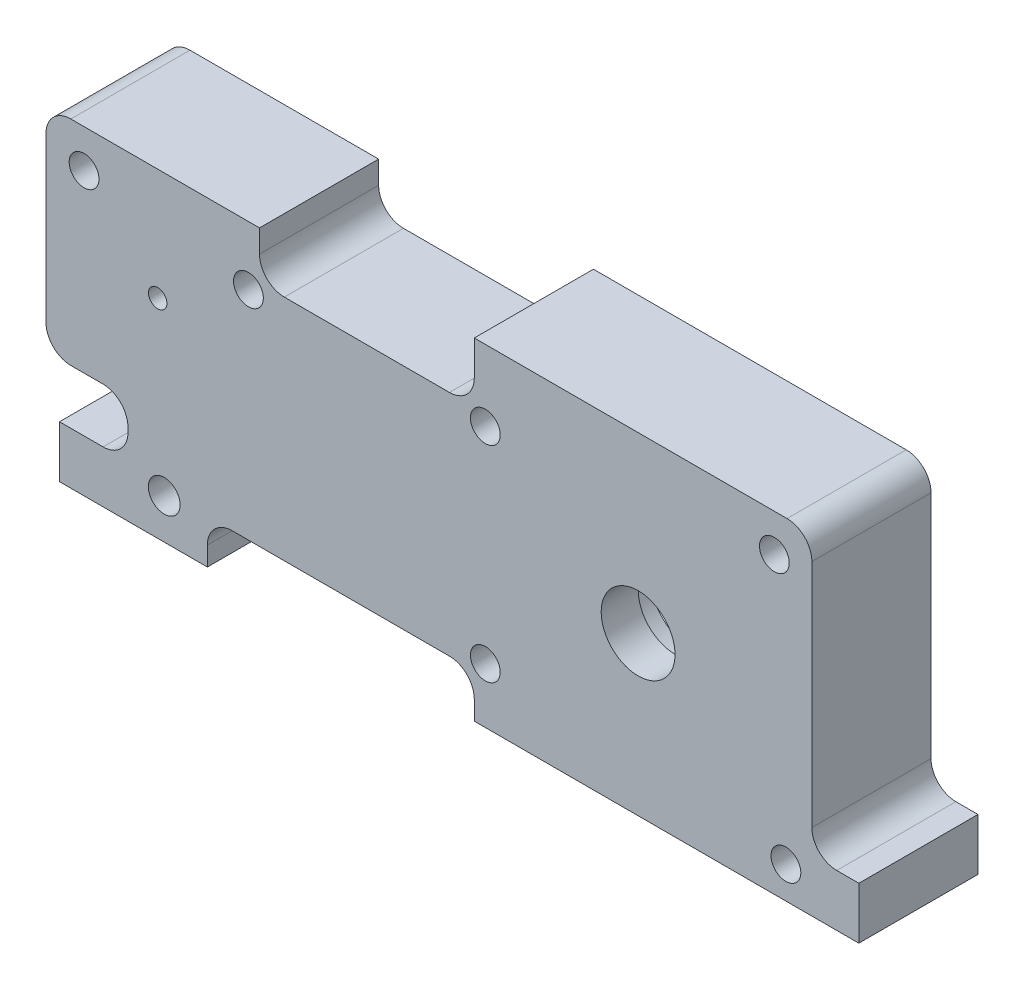
from build123d import *

# Parameters (mm, degrees)
EXTRUDE3_DEPTH = 15.24
EXTRUDE4_DEPTH = 6.477
SKETCH7_R      = 7.8994
EXTRUDE5_DEPTH = 4.0132
SKETCH8_R      = 2.2987
EXTRUDE6_DEPTH = 4.2926
SKETCH9_R      = 4.4196
EXTRUDE7_DEPTH = 4.4196
SKETCH10_R     = 4.7244
SKETCH10_R_2   = 1.905
SKETCH10_R_3   = 1.179287719
SKETCH10_R_4   = 2.031992692
EXTRUDE8_DEPTH = 17.5768


with BuildPart() as part:
    # Sketch4 → Extrude3 (new body)
    with BuildSketch(Plane.XY):
        with BuildLine():
            Line((-42.343481517, -2.990600597), (-42.343481517, 17.964399403))
            ThreePointArc((-42.343481517, 17.964399403), (-41.413545547, 20.209463433), (-39.168481517, 21.139399403))
            Line((-39.168481517, 21.139399403), (-15.038481517, 21.139399403))
            Line((-15.038481517, 21.139399403), (-15.038481517, 18.236569756))
            ThreePointArc((-15.038481517, 18.236569756), (-14.108545547, 15.991505726), (-11.863481517, 15.061569756))
            Line((-11.863481517, 15.061569756), (9.257081626, 15.061569756))
            ThreePointArc((9.257081626, 15.061569756), (11.502145656, 15.991505726), (12.432081626, 18.236569756))
            Line((12.432081626, 18.236569756), (12.432081626, 22.681569756))
            Line((12.432081626, 22.681569756), (52.437081626, 22.681569756))
            ThreePointArc((52.437081626, 22.681569756), (54.682145656, 21.751633786), (55.612081626, 19.506569756))
            Line((55.612081626, 19.506569756), (55.612081626, -9.945714332))
            ThreePointArc((55.612081626, -9.945714332), (56.542017596, -12.190778362), (58.787081626, -13.120714332))
            Line((58.787081626, -13.120714332), (61.618454053, -13.120714332))
            Line((61.618454053, -13.120714332), (61.618454053, -19.76149571))
            Line((61.618454053, -19.76149571), (12.432081626, -19.76149571))
            Line((12.432081626, -19.76149571), (12.432081626, -17.323430244))
            ThreePointArc((12.432081626, -17.323430244), (11.502145656, -15.078366214), (9.257081626, -14.148430244))
            Line((9.257081626, -14.148430244), (-18.530518374, -14.148430244))
            ThreePointArc((-18.530518374, -14.148430244), (-20.775582404, -15.078366214), (-21.705518374, -17.323430244))
            Line((-21.705518374, -17.323430244), (-21.705518374, -19.76149571))
            Line((-21.705518374, -19.76149571), (-40.618560355, -19.76149571))
            Line((-40.618560355, -19.76149571), (-40.618560355, -13.120714332))
            Line((-40.618560355, -13.120714332), (-35.040518374, -13.120714332))
            ThreePointArc((-35.040518374, -13.120714332), (-32.795454344, -12.190778362), (-31.865518374, -9.945714332))
            Line((-31.865518374, -9.945714332), (-31.865518374, -9.340600597))
            ThreePointArc((-31.865518374, -9.340600597), (-32.795454344, -7.095536567), (-35.040518374, -6.165600597))
            Line((-35.040518374, -6.165600597), (-39.168481517, -6.165600597))
            ThreePointArc((-39.168481517, -6.165600597), (-41.413545547, -5.235664628), (-42.343481517, -2.990600597))
        make_face()
    extrude(amount=EXTRUDE3_DEPTH)

    # Sketch1 → Extrude4 (cut)
    with BuildSketch(Plane.XY):
        with BuildLine():
            Line((-35.993481517, 11.614399403), (-35.993481517, 2.089399403))
            ThreePointArc((-35.993481517, 2.089399403), (-35.063545547, -0.155664628), (-32.818481517, -1.085600597))
            Line((-32.818481517, -1.085600597), (-26.785518374, -1.085600597))
            Line((-26.785518374, -1.085600597), (-26.785518374, -5.893430244))
            ThreePointArc((-26.785518374, -5.893430244), (-25.855582404, -8.138494274), (-23.610518374, -9.068430244))
            Line((-23.610518374, -9.068430244), (17.512081626, -9.068430244))
            Line((17.512081626, -9.068430244), (17.512081626, -12.243430244))
            ThreePointArc((17.512081626, -12.243430244), (18.442017596, -14.488494274), (20.687081626, -15.418430244))
            Line((20.687081626, -15.418430244), (46.087081626, -15.418430244))
            ThreePointArc((46.087081626, -15.418430244), (48.332145656, -14.488494274), (49.262081626, -12.243430244))
            Line((49.262081626, -12.243430244), (49.262081626, 13.156569756))
            ThreePointArc((49.262081626, 13.156569756), (48.332145656, 15.401633786), (46.087081626, 16.331569756))
            Line((46.087081626, 16.331569756), (20.687081626, 16.331569756))
            ThreePointArc((20.687081626, 16.331569756), (18.442017596, 15.401633786), (17.512081626, 13.156569756))
            Line((17.512081626, 13.156569756), (17.512081626, 9.981569756))
            Line((17.512081626, 9.981569756), (-20.118481517, 9.981569756))
            Line((-20.118481517, 9.981569756), (-20.118481517, 11.614399403))
            ThreePointArc((-20.118481517, 11.614399403), (-21.048417487, 13.859463433), (-23.293481517, 14.789399403))
            Line((-23.293481517, 14.789399403), (-32.818481517, 14.789399403))
            ThreePointArc((-32.818481517, 14.789399403), (-35.063545547, 13.859463433), (-35.993481517, 11.614399403))
        make_face()
    extrude(amount=EXTRUDE4_DEPTH, mode=Mode.SUBTRACT)

    # Sketch7 → Extrude5 (cut)
    with BuildSketch(Plane(origin=(0, 0, 6.477), x_dir=(-1, 0, 0), z_dir=(0, 0, -1))):
        with Locations((-33.387081626, 0.456569756)):
            Circle(SKETCH7_R)
    extrude(amount=-EXTRUDE5_DEPTH, mode=Mode.SUBTRACT)

    # Sketch8 → Extrude6 (cut)
    with BuildSketch(Plane(origin=(0, 0, 6.477), x_dir=(-1, 0, 0), z_dir=(0, 0, -1))):
        with Locations((-12.305081626, 0.456569756)):
            Circle(SKETCH8_R)
        with Locations((2.477718374, 0.456569756)):
            Circle(SKETCH8_R)
        with Locations((17.260518374, 0.456569756)):
            Circle(SKETCH8_R)
    extrude(amount=-EXTRUDE6_DEPTH, mode=Mode.SUBTRACT)

    # Sketch9 → Extrude7 (cut)
    with BuildSketch(Plane(origin=(0, 0, 6.477), x_dir=(-1, 0, 0), z_dir=(0, 0, -1))):
        with Locations((28.055981517, 6.851899403)):
            Circle(SKETCH9_R)
    extrude(amount=-EXTRUDE7_DEPTH, mode=Mode.SUBTRACT)

    # Sketch10 → Extrude8 (cut, symmetric)
    with BuildSketch(Plane(origin=(0, 0, 10.4902), x_dir=(-1, 0, 0), z_dir=(0, 0, -1))):
        with Locations((-33.387081626, 0.456569756)):
            Circle(SKETCH10_R)
        with Locations((-52.287415303, -15.678066597)):
            Circle(SKETCH10_R_2)
        with Locations((28.055981517, 6.851899403)):
            Circle(SKETCH10_R_3)
        with Locations((37.474326825, 16.270244711)):
            Circle(SKETCH10_R_2)
        with Locations((-13.846294556, 13.596903192)):
            Circle(SKETCH10_R_2)
        with Locations((-13.846294556, -12.683763681)):
            Circle(SKETCH10_R_2)
        with Locations((27.221195322, -14.622613425)):
            Circle(SKETCH10_R_4)
        with Locations((-50.814973838, 17.884461968)):
            Circle(SKETCH10_R_2)
        with Locations((16.452694446, 13.596903192)):
            Circle(SKETCH10_R_2)
    extrude(amount=EXTRUDE8_DEPTH, both=True, mode=Mode.SUBTRACT)


solid = part.part
